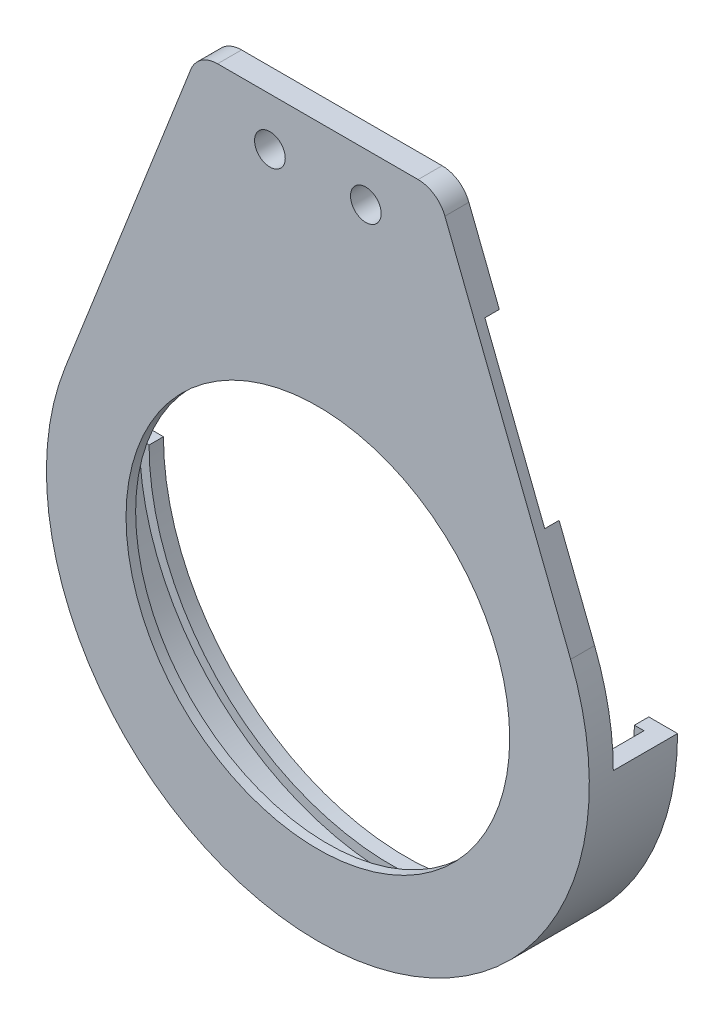
from build123d import *

# Parameters (mm, degrees)
SKETCH_1_R          = 28.3
SKETCH_1_R_2        = 20
EXTRUDE_1_DEPTH     = 2.5
EXTRUDE_START       = -2.5
SKETCH_2_R          = 1.6
EXTRUDE_2_DEPTH     = 2.5
EXTRUDE_START_2     = 5.2
EXTRUDE_3_DEPTH     = 5.2
EXTRUDE_START_3     = 1.5
EXTRUDE_4_DEPTH     = 1.5
CUT_EXTRUDE_START   = 10
CUT_EXTRUDE_1_DEPTH = 11.5
FILLET_1_R          = 3


with BuildPart() as part:
    # 草图1 → 凸台-拉伸1 (new body)
    with BuildSketch(Plane.XY):
        Circle(SKETCH_1_R)
        Circle(SKETCH_1_R_2, mode=Mode.SUBTRACT)
    extrude(amount=EXTRUDE_1_DEPTH)

    # 草图2 → 凸台-拉伸2 (add)
    with BuildSketch(Plane.XY.offset(2.5).offset(EXTRUDE_START)):
        with BuildLine():
            Line((-26.351833365, 10.318472674), (-12.5, 45.693979899))
            Line((-12.5, 45.693979899), (12.5, 45.693979899))
            Line((12.5, 45.693979899), (26.351833365, 10.318472674))
            ThreePointArc((26.351833365, 10.318472674), (0, 28.3), (-26.351833365, 10.318472674))
        make_face()
        with Locations((-5, 40.693979899)):
            Circle(SKETCH_2_R, mode=Mode.SUBTRACT)
        with Locations(Location((5, 40.693979899, 0), (0, 0, 180))):
            Circle(SKETCH_2_R, mode=Mode.SUBTRACT)
    extrude(amount=EXTRUDE_2_DEPTH)

    # 草图5 → 凸台-拉伸3 (add)
    with BuildSketch(Plane(origin=(0, 0, 0), x_dir=(-1, 0, 0), z_dir=(0, 0, -1)).offset(EXTRUDE_START_2)):
        with BuildLine():
            Line((-28.3, 0), (-26.3, 0))
            ThreePointArc((-26.3, 0), (0, -26.3), (26.3, 0))
            Line((26.3, 0), (28.3, 0))
            ThreePointArc((28.3, 0), (0, -28.3), (-28.3, 0))
        make_face()
    extrude(amount=-EXTRUDE_3_DEPTH)

    # 草图6 → 凸台-拉伸4 (add)
    with BuildSketch(Plane(origin=(0, 0, -5.2), x_dir=(-1, 0, 0), z_dir=(0, 0, -1)).offset(EXTRUDE_START_3)):
        with BuildLine():
            Line((-28.3, 0), (-25.3, 0))
            ThreePointArc((-25.3, 0), (0, -25.3), (25.3, 0))
            Line((25.3, 0), (28.3, 0))
            ThreePointArc((28.3, 0), (0, -28.3), (-28.3, 0))
        make_face()
    extrude(amount=-EXTRUDE_4_DEPTH)

    # 草图4 → 切除-拉伸1 (cut)
    with BuildSketch(Plane(origin=(0, 0, 0), x_dir=(-1, 0, 0), z_dir=(0, 0, -1)).offset(CUT_EXTRUDE_START)):
        with BuildLine():
            Line((-22.65, 0), (-22.65, 35.693979899))
            Line((-22.65, 35.693979899), (22.65, 35.693979899))
            Line((22.65, 35.693979899), (22.65, 0))
            ThreePointArc((22.65, 0), (0, -22.65), (-22.65, 0))
        make_face()
    extrude(amount=-CUT_EXTRUDE_1_DEPTH, mode=Mode.SUBTRACT)

    # 圆角1
    fillet_1_edges = [part.edges().sort_by_distance(p)[0] for p in [
        (-12.5, 45.693979899, 1.25),
        (12.5, 45.693979899, 1.25),
    ]]
    fillet(fillet_1_edges, radius=FILLET_1_R)


solid = part.part
